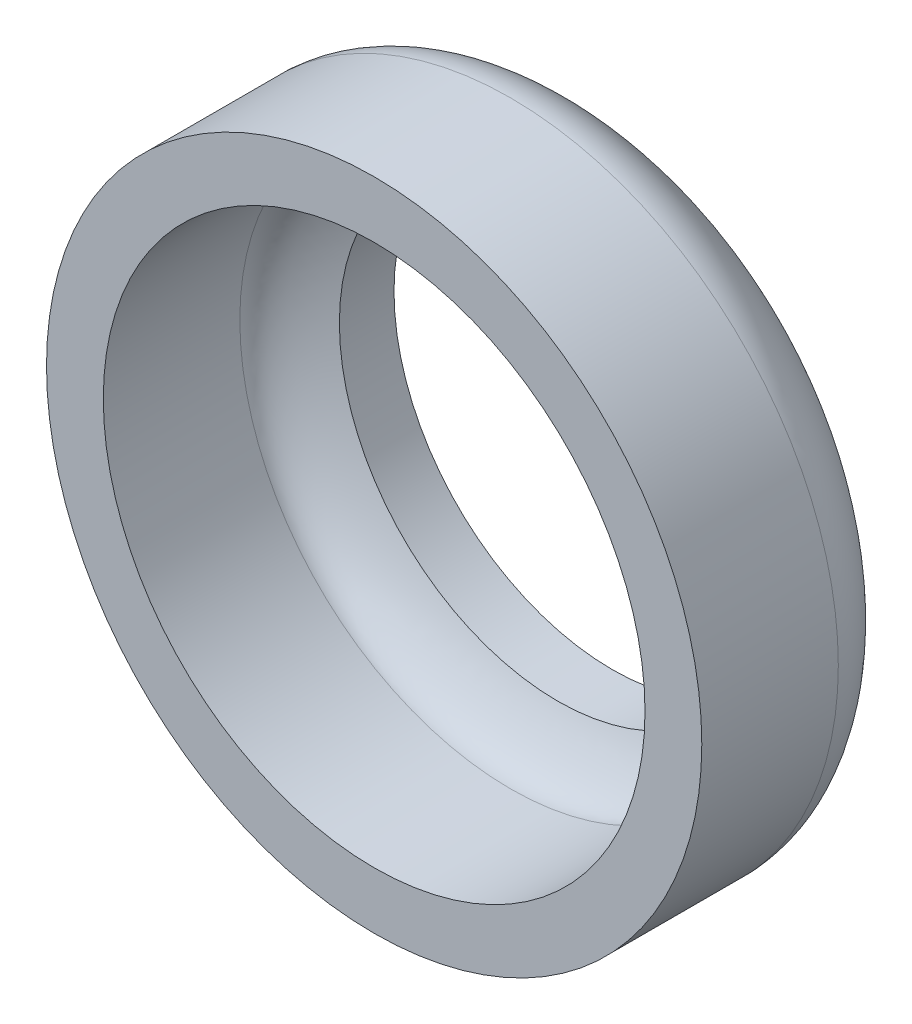
from build123d import *

# Parameters (mm, degrees)
CUT_EXTRUDE1_DEPTH      = 16.635061933
CUT_EXTRUDE1_DEPTH_BACK = 16.635061933
SKETCH3_R               = 6.35


with BuildPart() as part:
    # Sketch2 → Revolve1 (revolve)
    with BuildSketch(Plane(origin=(0, 0, 0), x_dir=(0, 0, -1), z_dir=(1, 0, 0)), mode=Mode.PRIVATE) as revolve1_sk:
        with BuildLine():
            Line((0, 9.525), (3.96875, 9.525))
            add(Edge.make_bspline(
                [(7.9375, 0), (7.9375, 9.525), (3.96875, 9.525)],
                knots=[4.71238898, 4.71238898, 4.71238898, 6.283185307, 6.283185307, 6.283185307], degree=2, weights=[1, 0.707106781, 1]))
            Line((7.9375, 0), (6.2865, 0))
            add(Edge.make_bspline(
                [(6.2865, 0), (6.2865, 7.874), (3.96875, 7.874)],
                knots=[4.71238898, 4.71238898, 4.71238898, 6.283185307, 6.283185307, 6.283185307], degree=2, weights=[1, 0.707106781, 1]))
            Line((3.96875, 7.874), (0, 7.874))
            Line((0, 7.874), (0, 9.525))
        make_face()
    revolve(revolve1_sk.sketch.rotate(Axis((0, 0, 0), (0, 0, -1)), 90), axis=Axis((0, 0, 0), (0, 0, -1)))

    # Sketch3 → Cut-Extrude1 (cut, two sides: drawn at the far end of the back side and taken through both)
    with BuildSketch(Plane.XY.offset(-CUT_EXTRUDE1_DEPTH_BACK)):
        Circle(SKETCH3_R)
    extrude(amount=CUT_EXTRUDE1_DEPTH + CUT_EXTRUDE1_DEPTH_BACK, mode=Mode.SUBTRACT)


solid = part.part
